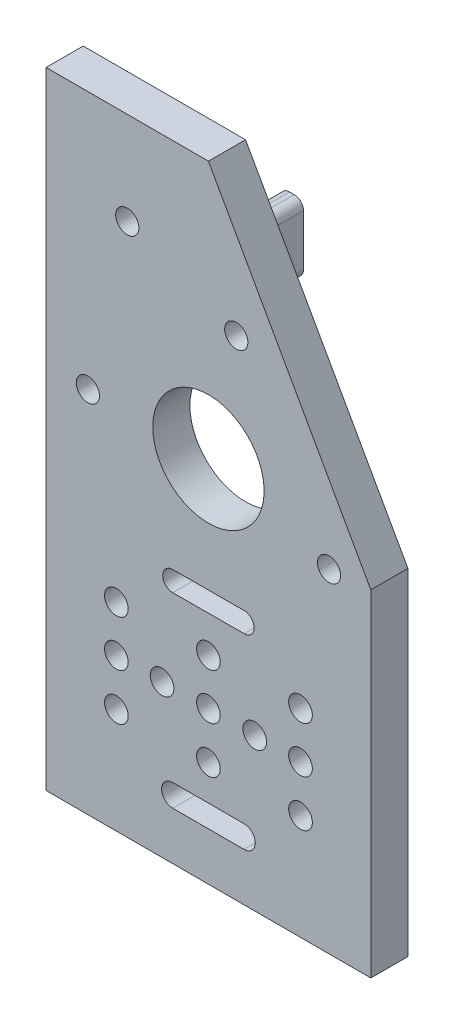
from build123d import *

# Parameters (mm, degrees)
ESQUISSE1_R             = 2.5
BOSS_EXTRU_1_DEPTH      = 8
BOSS_EXTRU_3_DEPTH      = 15
CONG_1_R                = 1
ESQUISSE5_R             = 3.75
ENL_V_MAT_EXTRU_1_DEPTH = 1.75
ESQUISSE6_R             = 2.55
ENL_V_MAT_EXTRU_2_DEPTH = 153.807067899
ENL_V_MAT_EXTRU_3_DEPTH = 153.807067899
BOSS_EXTRU_4_DEPTH      = 3
CONG_2_R                = 0.5
ESQUISSE10_R            = 12
ENL_V_MAT_EXTRU_4_DEPTH = 153.807067899
ESQUISSE11_R            = 2.5
ENL_V_MAT_EXTRU_5_DEPTH = 153.807067899


with BuildPart() as part:
    # Esquisse1 → Boss.-Extru.1 (new body)
    with BuildSketch(Plane.XY):
        Polygon((0, 0), (70, 0), (70, 72.472327189), (35, 135), (0, 135), align=None)
        with Locations((17.5, 115)):
            Circle(ESQUISSE1_R, mode=Mode.SUBTRACT)
    extrude(amount=BOSS_EXTRU_1_DEPTH)

    # Esquisse4 → Boss.-Extru.3 (add)
    with BuildSketch(Plane(origin=(0, 0, 0), x_dir=(-1, 0, 0), z_dir=(0, 0, -1))):
        with BuildLine():
            Line((-27.49686293, 105), (-7.50313707, 105))
            Line((-7.50313707, 105), (-7.50313707, 113))
            ThreePointArc((-7.50313707, 113), (-6.917350632, 114.414213562), (-5.50313707, 115))
            Line((-5.50313707, 115), (-4.504414059, 115))
            ThreePointArc((-4.504414059, 115), (-3.090200496, 114.414213562), (-2.504414059, 113))
            Line((-2.504414059, 113), (-2.504414059, 102.004411464))
            ThreePointArc((-2.504414059, 102.004411464), (-3.090200496, 100.590197902), (-4.504414059, 100.004411464))
            Line((-4.504414059, 100.004411464), (-30.495585941, 100.004411464))
            ThreePointArc((-30.495585941, 100.004411464), (-31.909799504, 100.590197902), (-32.495585941, 102.004411464))
            Line((-32.495585941, 102.004411464), (-32.495585941, 113))
            ThreePointArc((-32.495585941, 113), (-31.909799504, 114.414213562), (-30.495585941, 115))
            Line((-30.495585941, 115), (-29.49686293, 115))
            ThreePointArc((-29.49686293, 115), (-28.082649368, 114.414213562), (-27.49686293, 113))
            Line((-27.49686293, 113), (-27.49686293, 105))
        make_face()
    extrude(amount=BOSS_EXTRU_3_DEPTH)

    # Congé1
    cong_1_edges = [part.edges().sort_by_distance(p)[0] for p in [
        (27.49686293, 109, 0),
        (28.082649368, 114.414213562, 0),
        (29.996224436, 115, 0),
        (31.909799504, 114.414213562, 0),
        (32.495585941, 107.502205732, 0),
        (31.909799504, 100.590197902, 0),
        (17.5, 100.004411464, 0),
        (7.50313707, 109, 0),
        (6.917350632, 114.414213562, 0),
        (5.003775564, 115, 0),
        (3.090200496, 114.414213562, 0),
        (2.504414059, 107.502205732, 0),
        (3.090200496, 100.590197902, 0),
    ]]
    fillet(cong_1_edges, radius=CONG_1_R)

    # Esquisse5 → Enlèv. mat.-Extru.1 (cut)
    with BuildSketch(Plane(origin=(0, 0, 0), x_dir=(-1, 0, 0), z_dir=(0, 0, -1))):
        with Locations((-54.85, 52.748281044)):
            Circle(ESQUISSE5_R)
        with Locations((-15.15, 52.748281044)):
            Circle(ESQUISSE5_R)
        with Locations((-54.85, 12.75)):
            Circle(ESQUISSE5_R)
        with Locations((-15.15, 12.75)):
            Circle(ESQUISSE5_R)
    extrude(amount=-ENL_V_MAT_EXTRU_1_DEPTH, mode=Mode.SUBTRACT)

    # Esquisse6 → Enlèv. mat.-Extru.2 (cut, through all)
    with BuildSketch(Plane(origin=(0, 0, 0), x_dir=(-1, 0, 0), z_dir=(0, 0, -1))):
        with Locations((-54.846908299, 42.752516513)):
            Circle(ESQUISSE6_R)
        with Locations((-34.997746817, 42.752516513)):
            Circle(ESQUISSE6_R)
        with Locations((-54.846908299, 32.788691402)):
            Circle(ESQUISSE6_R)
        with Locations((-44.984599054, 32.788691402)):
            Circle(ESQUISSE6_R)
        with Locations((-34.997746817, 32.788691402)):
            Circle(ESQUISSE6_R)
        with Locations((-25.000410905, 32.788691402)):
            Circle(ESQUISSE6_R)
        with Locations((-15.150407315, 42.752516513)):
            Circle(ESQUISSE6_R)
        with Locations((-15.15, 32.788691402)):
            Circle(ESQUISSE6_R)
        with Locations((-15.15, 22.746834884)):
            Circle(ESQUISSE6_R)
        with Locations((-34.997746817, 22.746834884)):
            Circle(ESQUISSE6_R)
        with Locations((-54.846908299, 22.746834884)):
            Circle(ESQUISSE6_R)
    extrude(amount=-ENL_V_MAT_EXTRU_2_DEPTH, mode=Mode.SUBTRACT)

    # Esquisse7 → Enlèv. mat.-Extru.3 (cut, through all)
    with BuildSketch(Plane(origin=(0, 0, 0), x_dir=(-1, 0, 0), z_dir=(0, 0, -1))):
        with BuildLine():
            Line((-42.688697109, 54.953454119), (-27.29882218, 54.909006883))
            ThreePointArc((-27.29882218, 54.909006883), (-25.144336695, 52.742040688), (-27.311302891, 50.587555204))
            Line((-27.311302891, 50.587555204), (-42.70117782, 50.63200244))
            ThreePointArc((-42.70117782, 50.63200244), (-44.855663305, 52.798968635), (-42.688697109, 54.953454119))
        make_face()
        with BuildLine():
            Line((-42.694937465, 15.15279537), (-27.305062535, 15.15279537))
            ThreePointArc((-27.305062535, 15.15279537), (-24.902267165, 12.75), (-27.305062535, 10.34720463))
            Line((-27.305062535, 10.34720463), (-42.694937465, 10.34720463))
            ThreePointArc((-42.694937465, 10.34720463), (-45.097732835, 12.75), (-42.694937465, 15.15279537))
        make_face()
    extrude(amount=-ENL_V_MAT_EXTRU_3_DEPTH, mode=Mode.SUBTRACT)

    # Esquisse8 → Boss.-Extru.4 (add)
    with BuildSketch(Plane(origin=(0, 0, 0), x_dir=(-1, 0, 0), z_dir=(0, 0, -1))):
        with BuildLine():
            Line((-58.096218294, 61.887268694), (-51.603781706, 61.887268694))
            ThreePointArc((-51.603781706, 61.887268694), (-50.166286551, 60.449773539), (-51.603781706, 59.012278383))
            Line((-51.603781706, 59.012278383), (-58.096218294, 59.012278383))
            ThreePointArc((-58.096218294, 59.012278383), (-59.533713449, 60.449773539), (-58.096218294, 61.887268694))
        make_face()
        with BuildLine():
            Line((-11.903781706, 61.887268694), (-18.396218294, 61.887268694))
            ThreePointArc((-18.396218294, 61.887268694), (-19.833713449, 60.449773539), (-18.396218294, 59.012278383))
            Line((-18.396218294, 59.012278383), (-11.903781706, 59.012278383))
            ThreePointArc((-11.903781706, 59.012278383), (-10.466286551, 60.449773539), (-11.903781706, 61.887268694))
        make_face()
        with BuildLine():
            Line((-58.096218294, 3.690114109), (-51.603781706, 3.690114109))
            ThreePointArc((-51.603781706, 3.690114109), (-50.166286551, 5.127609265), (-51.603781706, 6.56510442))
            Line((-51.603781706, 6.56510442), (-58.096218294, 6.56510442))
            ThreePointArc((-58.096218294, 6.56510442), (-59.533713449, 5.127609265), (-58.096218294, 3.690114109))
        make_face()
        with BuildLine():
            Line((-11.903781706, 3.690114109), (-18.396218294, 3.690114109))
            ThreePointArc((-18.396218294, 3.690114109), (-19.833713449, 5.127609265), (-18.396218294, 6.56510442))
            Line((-18.396218294, 6.56510442), (-11.903781706, 6.56510442))
            ThreePointArc((-11.903781706, 6.56510442), (-10.466286551, 5.127609265), (-11.903781706, 3.690114109))
        make_face()
    extrude(amount=BOSS_EXTRU_4_DEPTH)

    # Congé2
    cong_2_edges = [part.edges().sort_by_distance(p)[0] for p in [
        (19.833713449, 5.127609265, -3),
        (15.15, 6.56510442, -3),
        (59.533713449, 5.127609265, -3),
        (54.85, 6.56510442, -3),
        (19.833713449, 60.449773539, -3),
        (15.15, 61.887268694, -3),
        (59.533713449, 60.449773539, -3),
        (54.85, 61.887268694, -3),
        (15.15, 3.690114109, -3),
        (10.466286551, 5.127609265, -3),
        (54.85, 3.690114109, -3),
        (50.166286551, 5.127609265, -3),
        (15.15, 59.012278383, -3),
        (10.466286551, 60.449773539, -3),
        (54.85, 59.012278383, -3),
        (50.166286551, 60.449773539, -3),
    ]]
    fillet(cong_2_edges, radius=CONG_2_R)

    # Esquisse10 → Enlèv. mat.-Extru.4 (cut, through all)
    with BuildSketch(Plane(origin=(0, 0, 0), x_dir=(-1, 0, 0), z_dir=(0, 0, -1))):
        with Locations((-35, 79.405545715)):
            Circle(ESQUISSE10_R)
    extrude(amount=-ENL_V_MAT_EXTRU_4_DEPTH, mode=Mode.SUBTRACT)

    # Esquisse11 → Enlèv. mat.-Extru.5 (cut, through all)
    with BuildSketch(Plane(origin=(0, 0, 0), x_dir=(-1, 0, 0), z_dir=(0, 0, -1))):
        with Locations((-61, 71.814130875)):
            Circle(ESQUISSE11_R)
        with Locations((-9, 79.404327963)):
            Circle(ESQUISSE11_R)
        with Locations((-41, 105.405545715)):
            Circle(ESQUISSE11_R)
    extrude(amount=-ENL_V_MAT_EXTRU_5_DEPTH, mode=Mode.SUBTRACT)


solid = part.part
